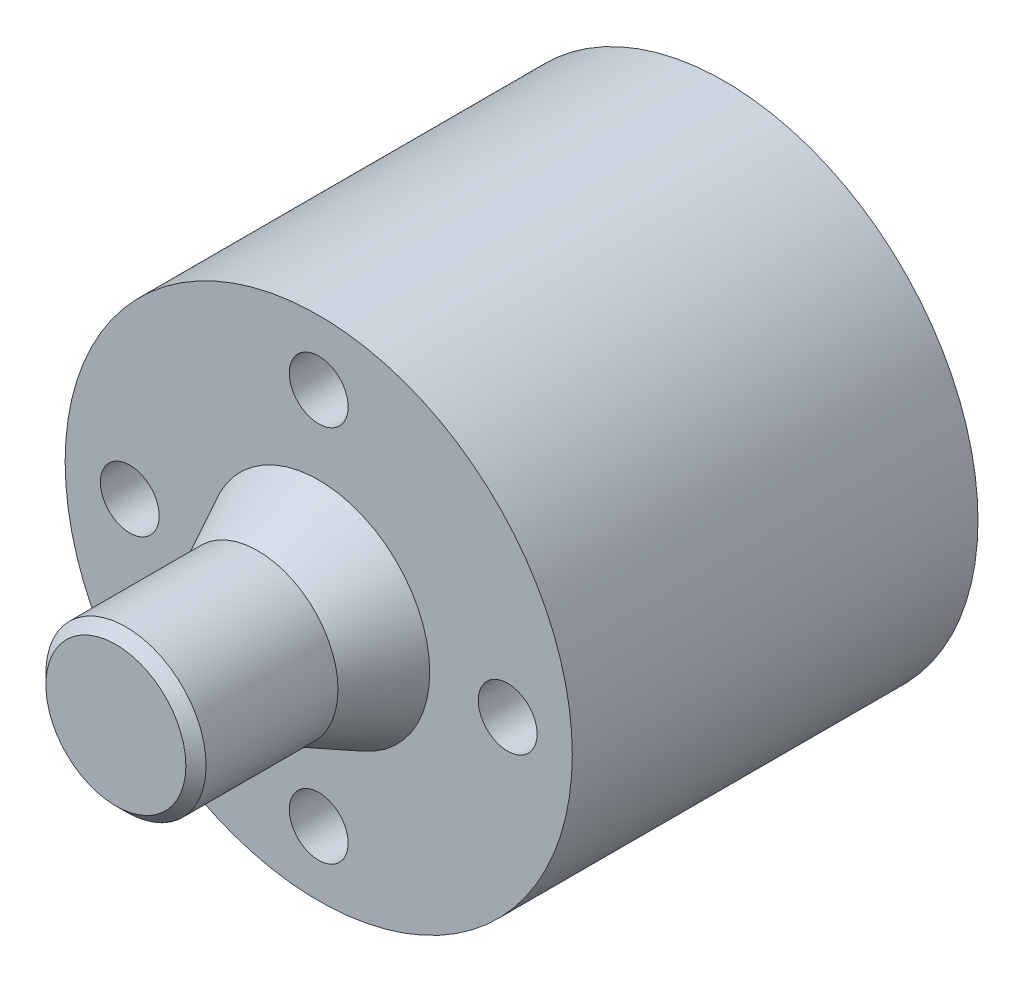
from build123d import *

# Parameters (mm, degrees)
SKETCH1_R           = 12.5
BOSS_EXTRUDE1_DEPTH = 7.5
CUT_EXTRUDE1_REACH  = 25.184
SKETCH8_W           = 12.25
SKETCH8_H           = 12.25
SKETCH11_R          = 1.45
CUT_EXTRUDE4_DEPTH  = 24.184046239
BOSS_EXTRUDE2_START = 5
SKETCH14_R          = 12.5
BOSS_EXTRUDE2_DEPTH = 5
SKETCH15_R          = 3.95
BOSS_EXTRUDE3_DEPTH = 7
CHAMFER1_SIZE       = 0.5
SKETCH18_R          = 1.45
CUT_EXTRUDE6_DEPTH  = 30


with BuildPart() as part:
    # Sketch1 → Boss-Extrude1 (new, symmetric)
    with BuildSketch(Plane.XY):
        Circle(SKETCH1_R)
    extrude(amount=BOSS_EXTRUDE1_DEPTH, both=True)

    # Sketch8 → Cut-Extrude1 (cut, up to next)
    with BuildSketch(Plane.XY.offset(7.5), mode=Mode.PRIVATE) as cut_extrude1_sk1:
        Rectangle(SKETCH8_W, SKETCH8_H)
    cut_extrude1_tool1 = extrude(cut_extrude1_sk1.sketch, amount=-CUT_EXTRUDE1_REACH, mode=Mode.PRIVATE) & part.part
    add(cut_extrude1_tool1.solids().sort_by_distance((0, 0, 7.5))[0], mode=Mode.SUBTRACT)

    # Sketch11 → Cut-Extrude4 (cut, through all)
    with BuildSketch(Plane.XY.offset(7.5)):
        with Locations((9.315, 0)):
            Circle(SKETCH11_R)
        with Locations((0, -9.315)):
            Circle(SKETCH11_R)
        with Locations((-9.315, 0)):
            Circle(SKETCH11_R)
        with Locations((0, 9.315)):
            Circle(SKETCH11_R)
    extrude(amount=-CUT_EXTRUDE4_DEPTH, mode=Mode.SUBTRACT)

    # Sketch14 → Boss-Extrude2 (add)
    with BuildSketch(Plane.XY.offset(7.5).offset(BOSS_EXTRUDE2_START)):
        Circle(SKETCH14_R)
    extrude(amount=-BOSS_EXTRUDE2_DEPTH)

    # Sketch13 → Revolve1 (revolve)
    with BuildSketch(Plane(origin=(0, 0, 0), x_dir=(1, 0, 0), z_dir=(0, 1, 0)), mode=Mode.PRIVATE) as revolve1_sk:
        Polygon((0, -15.5), (3.95, -15.5), (7.5, -8.506732209), (0, -8.506732209), align=None)
    revolve(revolve1_sk.sketch.rotate(Axis((0, 0, 11.965062333), (0, 0, 1)), 180), axis=Axis((0, 0, 11.965062333), (0, 0, 1)))

    # Sketch15 → Boss-Extrude3 (add)
    with BuildSketch(Plane.XY.offset(15.5)):
        Circle(SKETCH15_R)
    extrude(amount=BOSS_EXTRUDE3_DEPTH)

    # Chamfer1
    chamfer1_edges = [part.edges().sort_by_distance(p)[0] for p in [
        (-3.95, 0, 22.5),
    ]]
    chamfer(chamfer1_edges, length=CHAMFER1_SIZE)

    # Sketch18 → Cut-Extrude6 (cut)
    with BuildSketch(Plane.XY.offset(12.5)):
        with Locations((-9.315, 0)):
            Circle(SKETCH18_R)
        with Locations((0, -9.315)):
            Circle(SKETCH18_R)
        with Locations((9.315, 0)):
            Circle(SKETCH18_R)
        with Locations((0, 9.315)):
            Circle(SKETCH18_R)
    extrude(amount=-CUT_EXTRUDE6_DEPTH, mode=Mode.SUBTRACT)


solid = part.part
